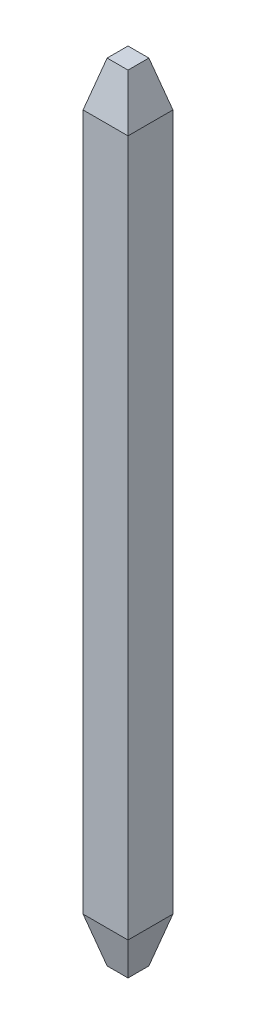
from build123d import *
from OCP.BRepFilletAPI import BRepFilletAPI_MakeChamfer

# Parameters (mm, degrees)
SKETCH1_W           = 0.4
SKETCH1_H           = 0.4
BOSS_EXTRUDE1_DEPTH = 3.5
CHAMFER2_SIZE       = 0.4
CHAMFER2_SIZE2      = 0.107179677
CHAMFER3_SIZE       = 0.4
CHAMFER3_SIZE2      = 0.107179677


with BuildPart() as part:
    # Sketch1 → Boss-Extrude1 (new, symmetric)
    with BuildSketch(Plane(origin=(0, 0, 0), x_dir=(1, 0, 0), z_dir=(0, 1, 0))):
        Rectangle(SKETCH1_W, SKETCH1_H)
    extrude(amount=BOSS_EXTRUDE1_DEPTH, both=True)

    # Chamfer2: one chamfer whose edges measure the first distance from different faces: ONE call of the kernel's chamfer builder (chamfer() names one face for all edges)
    chamfer2_edges_1 = [part.edges().sort_by_distance(p)[0] for p in [
        (-0.2, 3.5, 0),
    ]]
    chamfer2_side_1 = [part.faces().sort_by_distance(p)[0] for p in [
        (-0.2, 0, 0),
    ]]
    chamfer2_edges_2 = [part.edges().sort_by_distance(p)[0] for p in [
        (0, 3.5, 0.2),
    ]]
    chamfer2_side_2 = [part.faces().sort_by_distance(p)[0] for p in [
        (0, 0, 0.2),
    ]]
    chamfer2_edges_3 = [part.edges().sort_by_distance(p)[0] for p in [
        (0.2, 3.5, 0),
    ]]
    chamfer2_side_3 = [part.faces().sort_by_distance(p)[0] for p in [
        (0.2, 0, 0),
    ]]
    chamfer2_edges_4 = [part.edges().sort_by_distance(p)[0] for p in [
        (0, 3.5, -0.2),
    ]]
    chamfer2_side_4 = [part.faces().sort_by_distance(p)[0] for p in [
        (0, 0, -0.2),
    ]]
    chamfer2 = BRepFilletAPI_MakeChamfer(part.part.solid().wrapped)
    for e in chamfer2_edges_1:
        chamfer2.Add(CHAMFER2_SIZE, CHAMFER2_SIZE2, e.wrapped, chamfer2_side_1[0].wrapped)  # the first distance lies on this face
    for e in chamfer2_edges_2:
        chamfer2.Add(CHAMFER2_SIZE, CHAMFER2_SIZE2, e.wrapped, chamfer2_side_2[0].wrapped)  # the first distance lies on this face
    for e in chamfer2_edges_3:
        chamfer2.Add(CHAMFER2_SIZE, CHAMFER2_SIZE2, e.wrapped, chamfer2_side_3[0].wrapped)  # the first distance lies on this face
    for e in chamfer2_edges_4:
        chamfer2.Add(CHAMFER2_SIZE, CHAMFER2_SIZE2, e.wrapped, chamfer2_side_4[0].wrapped)  # the first distance lies on this face
    add(Compound.cast(chamfer2.Shape()), mode=Mode.REPLACE)

    # Chamfer3: one chamfer whose edges measure the first distance from different faces: ONE call of the kernel's chamfer builder (chamfer() names one face for all edges)
    chamfer3_edges_1 = [part.edges().sort_by_distance(p)[0] for p in [
        (0, -3.5, 0.2),
    ]]
    chamfer3_side_1 = [part.faces().sort_by_distance(p)[0] for p in [
        (0, -0.2, 0.2),
    ]]
    chamfer3_edges_2 = [part.edges().sort_by_distance(p)[0] for p in [
        (-0.2, -3.5, 0),
    ]]
    chamfer3_side_2 = [part.faces().sort_by_distance(p)[0] for p in [
        (-0.2, -0.2, 0),
    ]]
    chamfer3_edges_3 = [part.edges().sort_by_distance(p)[0] for p in [
        (0, -3.5, -0.2),
    ]]
    chamfer3_side_3 = [part.faces().sort_by_distance(p)[0] for p in [
        (0, -0.2, -0.2),
    ]]
    chamfer3_edges_4 = [part.edges().sort_by_distance(p)[0] for p in [
        (0.2, -3.5, 0),
    ]]
    chamfer3_side_4 = [part.faces().sort_by_distance(p)[0] for p in [
        (0.2, -0.2, 0),
    ]]
    chamfer3 = BRepFilletAPI_MakeChamfer(part.part.solid().wrapped)
    for e in chamfer3_edges_1:
        chamfer3.Add(CHAMFER3_SIZE, CHAMFER3_SIZE2, e.wrapped, chamfer3_side_1[0].wrapped)  # the first distance lies on this face
    for e in chamfer3_edges_2:
        chamfer3.Add(CHAMFER3_SIZE, CHAMFER3_SIZE2, e.wrapped, chamfer3_side_2[0].wrapped)  # the first distance lies on this face
    for e in chamfer3_edges_3:
        chamfer3.Add(CHAMFER3_SIZE, CHAMFER3_SIZE2, e.wrapped, chamfer3_side_3[0].wrapped)  # the first distance lies on this face
    for e in chamfer3_edges_4:
        chamfer3.Add(CHAMFER3_SIZE, CHAMFER3_SIZE2, e.wrapped, chamfer3_side_4[0].wrapped)  # the first distance lies on this face
    add(Compound.cast(chamfer3.Shape()), mode=Mode.REPLACE)


solid = part.part
